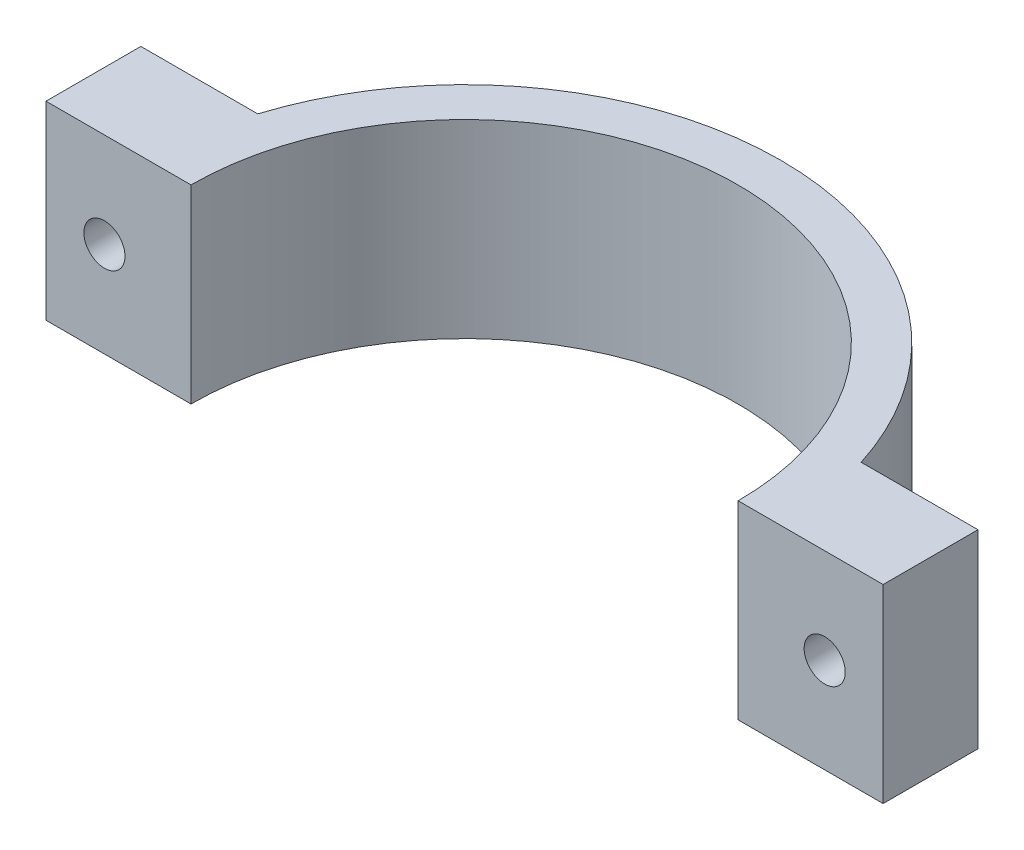
from build123d import *

# Parameters (mm, degrees)
BOSS_EXTRUDE1_DEPTH = 15
SKETCH2_R           = 3.25
CUT_EXTRUDE1_DEPTH  = 77.348743441


with BuildPart() as part:
    # Sketch1 → Boss-Extrude1 (new, symmetric)
    with BuildSketch(Plane(origin=(0, 0, 0), x_dir=(1, 0, 0), z_dir=(0, 1, 0))):
        with BuildLine():
            Line((-66.175, 0), (-66.175, 15))
            Line((-66.175, 15), (-47.696960071, 15))
            ThreePointArc((-47.696960071, 15), (0, 50), (47.696960071, 15))
            Line((47.696960071, 15), (66.175, 15))
            Line((66.175, 15), (66.175, 0))
            Line((66.175, 0), (43.25, 0))
            ThreePointArc((43.25, 0), (0, 43.25), (-43.25, 0))
            Line((-43.25, 0), (-66.175, 0))
        make_face()
    extrude(amount=BOSS_EXTRUDE1_DEPTH, both=True)

    # Sketch2 → Cut-Extrude1 (cut, through all)
    with BuildSketch(Plane(origin=(0, 0, -15), x_dir=(-1, 0, 0), z_dir=(0, 0, -1))):
        with Locations((56.935980035, 0)):
            Circle(SKETCH2_R)
        with Locations((-56.935980035, 0)):
            Circle(SKETCH2_R)
    extrude(amount=-CUT_EXTRUDE1_DEPTH, mode=Mode.SUBTRACT)


solid = part.part
